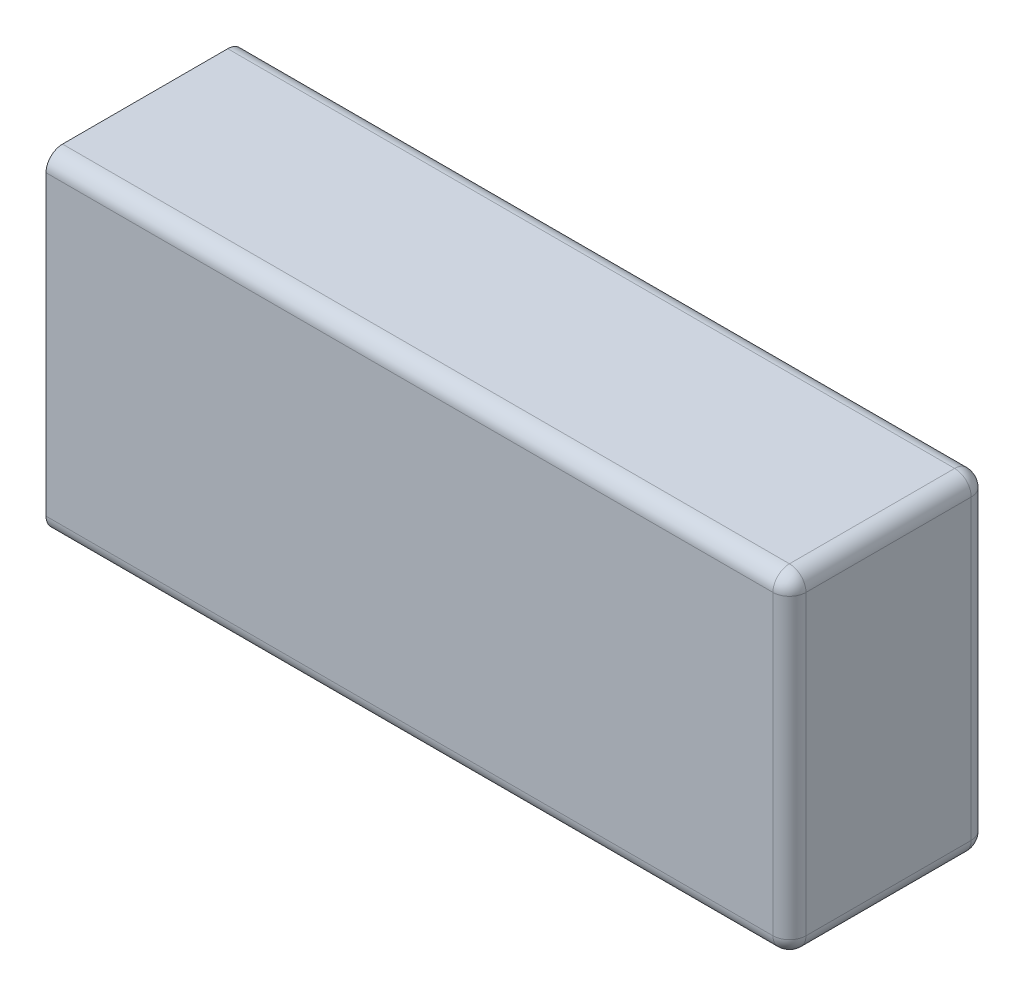
from build123d import *

# Parameters (mm, degrees)
EXTRUDE_1_DEPTH = 45
FILLET_1_R      = 1


with BuildPart() as part:
    # Эскиз1 → Бобышка-Вытянуть1 (new body)
    with BuildSketch(Plane(origin=(0, 0, 0), x_dir=(0, 0, -1), z_dir=(1, 0, 0))):
        with BuildLine():
            Line((-6, -9), (-6, 9))
            ThreePointArc((-6, 9), (-5.707106781, 9.707106781), (-5, 10))
            Line((-5, 10), (5, 10))
            ThreePointArc((5, 10), (5.707106781, 9.707106781), (6, 9))
            Line((6, 9), (6, -9))
            ThreePointArc((6, -9), (5.707106781, -9.707106781), (5, -10))
            Line((5, -10), (-5, -10))
            ThreePointArc((-5, -10), (-5.707106781, -9.707106781), (-6, -9))
        make_face()
    extrude(amount=EXTRUDE_1_DEPTH)

    # Скругление1
    fillet_1_edges = [part.edges().sort_by_distance(p)[0] for p in [
        (45, -9.707106781, 5.707106781),
        (45, -10, 0),
        (45, -9.707106781, -5.707106781),
        (45, 0, -6),
        (45, 9.707106781, -5.707106781),
        (45, 10, 0),
        (45, 9.707106781, 5.707106781),
        (45, 0, 6),
    ]]
    fillet(fillet_1_edges, radius=FILLET_1_R)


solid = part.part
